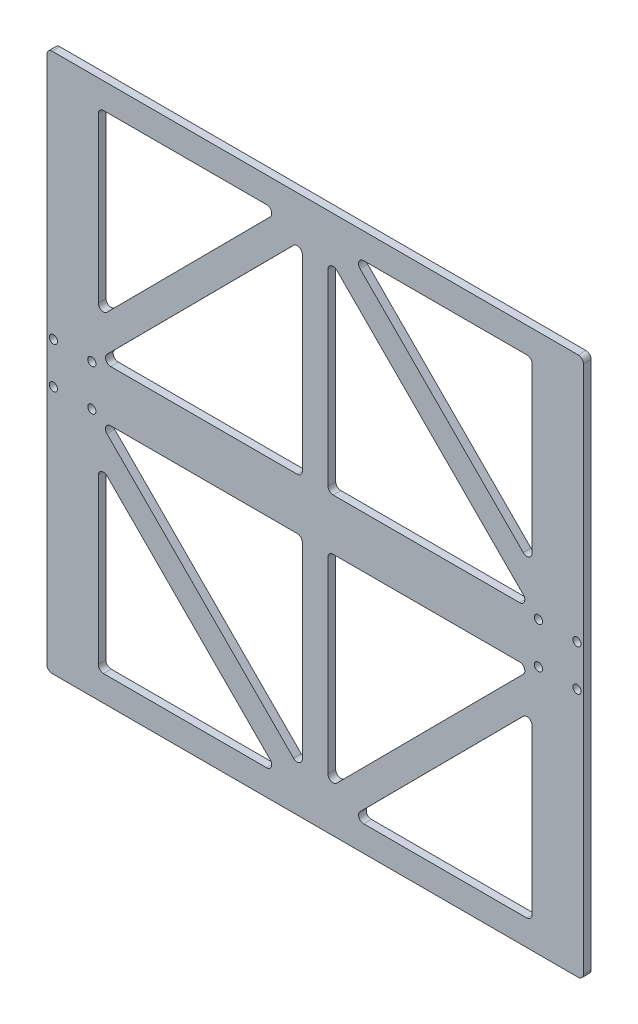
from build123d import *

# Parameters (mm, degrees)
SKETCH_1_R      = 1.6
EXTRUDE_1_DEPTH = 3


with BuildPart() as part:
    # 草图1 → 凸台-拉伸1 (new body)
    with BuildSketch(Plane.XY):
        with BuildLine():
            Line((2, 0), (207, 0))
            ThreePointArc((207, 0), (208.414213562, 0.585786438), (209, 2))
            Line((209, 2), (209, 208))
            ThreePointArc((209, 208), (208.414213562, 209.414213562), (207, 210))
            Line((207, 210), (2, 210))
            ThreePointArc((2, 210), (0.585786438, 209.414213562), (0, 208))
            Line((0, 208), (0, 2))
            ThreePointArc((0, 2), (0.585786438, 0.585786438), (2, 0))
        make_face()
        with Locations((2.5, 97)):
            Circle(SKETCH_1_R, mode=Mode.SUBTRACT)
        with Locations((17.5, 97)):
            Circle(SKETCH_1_R, mode=Mode.SUBTRACT)
        with Locations(Location((17.5, 113, 0), (0, 0, 180))):
            Circle(SKETCH_1_R, mode=Mode.SUBTRACT)
        with Locations(Location((2.5, 113, 0), (0, 0, 180))):
            Circle(SKETCH_1_R, mode=Mode.SUBTRACT)
        with Locations(Location((206.5, 97, 0), (0, 0, 180))):
            Circle(SKETCH_1_R, mode=Mode.SUBTRACT)
        with Locations(Location((191.5, 97, 0), (0, 0, 180))):
            Circle(SKETCH_1_R, mode=Mode.SUBTRACT)
        with Locations((191.5, 113)):
            Circle(SKETCH_1_R, mode=Mode.SUBTRACT)
        with Locations((206.5, 113)):
            Circle(SKETCH_1_R, mode=Mode.SUBTRACT)
        with BuildLine():
            Line((24.808355785, 95), (97.5, 95))
            ThreePointArc((97.5, 95), (98.914213562, 94.414213562), (99.5, 93))
            Line((99.5, 93), (99.5, 19.878227713))
            ThreePointArc((99.5, 19.878227713), (98.262640733, 18.029341802), (96.081620887, 18.468192007))
            Line((96.081620887, 18.468192007), (23.389976673, 91.589964294))
            ThreePointArc((23.389976673, 91.589964294), (22.961727586, 93.768091332), (24.808355785, 95))
        make_face(mode=Mode.SUBTRACT)
        with BuildLine():
            Line((112.918379113, 18.468192007), (185.610023327, 91.589964294))
            ThreePointArc((185.610023327, 91.589964294), (186.038272414, 93.768091332), (184.191644215, 95))
            Line((184.191644215, 95), (111.5, 95))
            ThreePointArc((111.5, 95), (110.085786438, 94.414213562), (109.5, 93))
            Line((109.5, 93), (109.5, 19.878227713))
            ThreePointArc((109.5, 19.878227713), (110.737359267, 18.029341802), (112.918379113, 18.468192007))
        make_face(mode=Mode.SUBTRACT)
        with BuildLine():
            Line((20, 75.967320112), (20, 12))
            ThreePointArc((20, 12), (20.585786438, 10.585786438), (22, 10))
            Line((22, 10), (85.591041759, 10))
            ThreePointArc((85.591041759, 10), (87.437669958, 11.231908668), (87.009420872, 13.410035706))
            Line((87.009420872, 13.410035706), (23.418379113, 77.377355819))
            ThreePointArc((23.418379113, 77.377355819), (21.237359267, 77.816206024), (20, 75.967320112))
        make_face(mode=Mode.SUBTRACT)
        with BuildLine():
            Line((121.990579128, 13.410035706), (185.581620887, 77.377355819))
            ThreePointArc((185.581620887, 77.377355819), (187.762640733, 77.816206024), (189, 75.967320112))
            Line((189, 75.967320112), (189, 12))
            ThreePointArc((189, 12), (188.414213562, 10.585786438), (187, 10))
            Line((187, 10), (123.408958241, 10))
            ThreePointArc((123.408958241, 10), (121.562330042, 11.231908668), (121.990579128, 13.410035706))
        make_face(mode=Mode.SUBTRACT)
        with BuildLine():
            Line((187, 200), (123.408958241, 200))
            ThreePointArc((123.408958241, 200), (121.562330042, 198.768091332), (121.990579128, 196.589964294))
            Line((121.990579128, 196.589964294), (185.581620887, 132.622644181))
            ThreePointArc((185.581620887, 132.622644181), (187.762640733, 132.183793976), (189, 134.032679888))
            Line((189, 134.032679888), (189, 198))
            ThreePointArc((189, 198), (188.414213562, 199.414213562), (187, 200))
        make_face(mode=Mode.SUBTRACT)
        with BuildLine():
            Line((87.009420872, 196.589964294), (23.418379113, 132.622644181))
            ThreePointArc((23.418379113, 132.622644181), (21.237359267, 132.183793976), (20, 134.032679888))
            Line((20, 134.032679888), (20, 198))
            ThreePointArc((20, 198), (20.585786438, 199.414213562), (22, 200))
            Line((22, 200), (85.591041759, 200))
            ThreePointArc((85.591041759, 200), (87.437669958, 198.768091332), (87.009420872, 196.589964294))
        make_face(mode=Mode.SUBTRACT)
        with BuildLine():
            Line((184.191644215, 115), (111.5, 115))
            ThreePointArc((111.5, 115), (110.085786438, 115.585786438), (109.5, 117))
            Line((109.5, 117), (109.5, 190.121772287))
            ThreePointArc((109.5, 190.121772287), (110.737359267, 191.970658198), (112.918379113, 191.531807993))
            Line((112.918379113, 191.531807993), (185.610023327, 118.410035706))
            ThreePointArc((185.610023327, 118.410035706), (186.038272414, 116.231908668), (184.191644215, 115))
        make_face(mode=Mode.SUBTRACT)
        with BuildLine():
            Line((23.389976673, 118.410035706), (96.081620887, 191.531807993))
            ThreePointArc((96.081620887, 191.531807993), (98.262640733, 191.970658198), (99.5, 190.121772287))
            Line((99.5, 190.121772287), (99.5, 117))
            ThreePointArc((99.5, 117), (98.914213562, 115.585786438), (97.5, 115))
            Line((97.5, 115), (24.808355785, 115))
            ThreePointArc((24.808355785, 115), (22.961727586, 116.231908668), (23.389976673, 118.410035706))
        make_face(mode=Mode.SUBTRACT)
    extrude(amount=EXTRUDE_1_DEPTH)


solid = part.part
